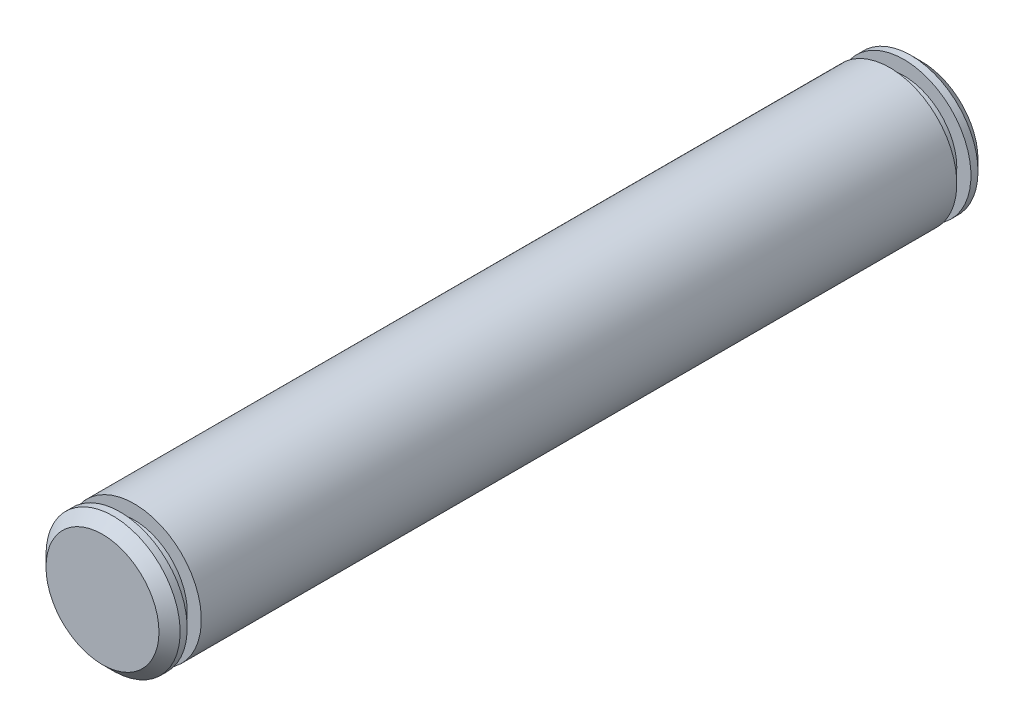
from build123d import *

# Parameters (mm, degrees)
ESQUISSE1_R                = 9.5
BASE_EXTRUSION_DEPTH       = 116
CHANFREIN1_SIZE            = 1.5
ESQUISSE2_R                = 12
ESQUISSE2_R_2              = 7.5
ENL_V_MAT_EXTRU_1_DEPTH    = 2
R_P_TITION_LIN_AIRE1_COUNT = 2
R_P_TITION_LIN_AIRE1_PITCH = 109


with BuildPart() as part:
    # Esquisse1 → Base-Extrusion (new body)
    with BuildSketch(Plane.XY):
        with Locations(Location((0, 0, 0), (0, 0, 180))):
            Circle(ESQUISSE1_R)
    extrude(amount=BASE_EXTRUSION_DEPTH)

    # Chanfrein1
    chanfrein1_edges = [part.edges().sort_by_distance(p)[0] for p in [
        (9.5, 0, 0),
        (9.5, 0, 116),
    ]]
    chamfer(chanfrein1_edges, length=CHANFREIN1_SIZE)

    # Esquisse2 → Enlèv. mat.-Extru.1 (cut)
    with BuildSketch(Plane.XY.offset(113.5)):
        Circle(ESQUISSE2_R)
        Circle(ESQUISSE2_R_2, mode=Mode.SUBTRACT)
    enl_v_mat_extru_1 = extrude(amount=-ENL_V_MAT_EXTRU_1_DEPTH, mode=Mode.SUBTRACT)

    # Répétition linéaire1: Enlèv. mat.-Extru.1 ×2
    with Locations(*[(0, 0, -i * R_P_TITION_LIN_AIRE1_PITCH) for i in range(1, R_P_TITION_LIN_AIRE1_COUNT)]):
        add(enl_v_mat_extru_1, mode=Mode.SUBTRACT)


solid = part.part
